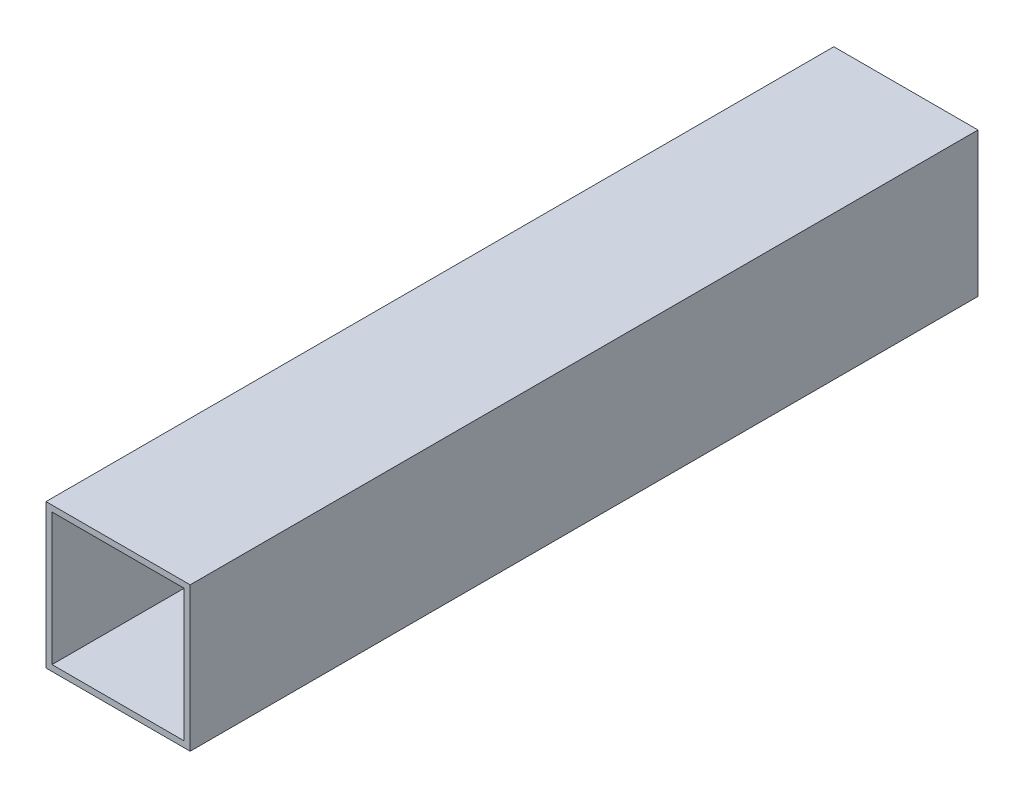
from build123d import *

# Parameters (mm, degrees)
SKETCH1_W           = 76.2
SKETCH1_H           = 76.2
SKETCH1_W_2         = 69.85
SKETCH1_H_2         = 69.85
BOSS_EXTRUDE1_DEPTH = 208.2


with BuildPart() as part:
    # Sketch1 → Boss-Extrude1 (new, symmetric)
    with BuildSketch(Plane.XY):
        Rectangle(SKETCH1_W, SKETCH1_H)
        Rectangle(SKETCH1_W_2, SKETCH1_H_2, mode=Mode.SUBTRACT)
    extrude(amount=BOSS_EXTRUDE1_DEPTH, both=True)


solid = part.part
